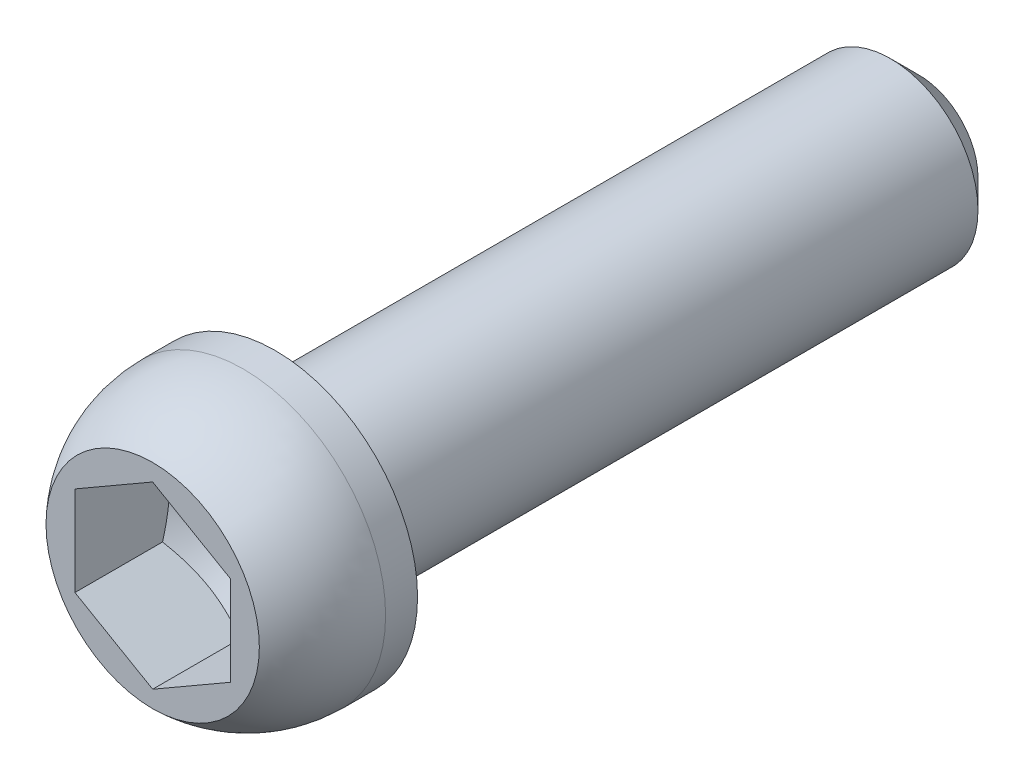
from build123d import *

# Parameters (mm, degrees)
CHANFREIN2_SIZE    = 0.65
BOSS_EXTRU_1_REACH = 20.094
ESQUISSE3_R        = 2.43636475


with BuildPart() as part:
    # Esquisse1 → Révolution1 (revolve)
    with BuildSketch(Plane(origin=(0, 0, 0), x_dir=(0, 0, -1), z_dir=(1, 0, 0)), mode=Mode.PRIVATE) as r_volution1_sk:
        with BuildLine():
            Line((17.5, 2), (2.8, 2))
            Line((2.8, 2), (2.8, 3.25))
            Line((2.8, 3.25), (2.07, 3.25))
            ThreePointArc((2.07, 3.25), (0.957918357, 3.039288677), (0, 2.43636475))
            Line((0, 2.43636475), (0, 0))
            Line((0, 0), (17.5, 0))
            Line((17.5, 0), (17.5, 2))
        make_face()
    revolve(r_volution1_sk.sketch.rotate(Axis((0, 0, -17.5), (0, 0, -1)), 90), axis=Axis((0, 0, -17.5), (0, 0, -1)))

    # Chanfrein2
    chanfrein2_edges = [part.edges().sort_by_distance(p)[0] for p in [
        (-2, 0, -17.5),
    ]]
    chamfer(chanfrein2_edges, length=CHANFREIN2_SIZE)

    # Esquisse2 → Enlèvement de matière-Révolution1 (revolve, cut)
    with BuildSketch(Plane(origin=(0, 0, 0), x_dir=(0, 0, -1), z_dir=(1, 0, 0)), mode=Mode.PRIVATE) as enl_vement_de_mati_re_r_volution1_sk:
        Polygon((0, 0), (0, 2.049593456), (2, 2.049593456), (3.183333333, 0), align=None)
    revolve(enl_vement_de_mati_re_r_volution1_sk.sketch.rotate(Axis((0, 0, 0), (0, 0, -1)), 90), axis=Axis((0, 0, 0), (0, 0, -1)), mode=Mode.SUBTRACT)

    # Boss.-Extru.1: up to this cone (the profile starts inside it)
    boss_extru_1_end = Plane(origin=(0, 0, 0), z_dir=(0, 0, 1)).offset(-3.183332333) * Cone(1.732e-06, 50.733549402, 29.291027404, align=(Align.CENTER, Align.CENTER, Align.MIN), mode=Mode.PRIVATE)
    # Esquisse3 → Boss.-Extru.1 (add, up to the surface)
    with BuildSketch(Plane.XY, mode=Mode.PRIVATE) as boss_extru_1_sk1:
        Circle(ESQUISSE3_R)
        Polygon((0, 2.049593456), (-1.775, 1.024796728), (-1.775, -1.024796728), (0, -2.049593456), (1.775, -1.024796728), (1.775, 1.024796728), align=None, mode=Mode.SUBTRACT)
    boss_extru_1_tool1 = extrude(boss_extru_1_sk1.sketch, amount=-BOSS_EXTRU_1_REACH, mode=Mode.PRIVATE) & boss_extru_1_end
    add(boss_extru_1_tool1.solids().sort_by_distance((-2.367454, 0, 0))[0])


solid = part.part
